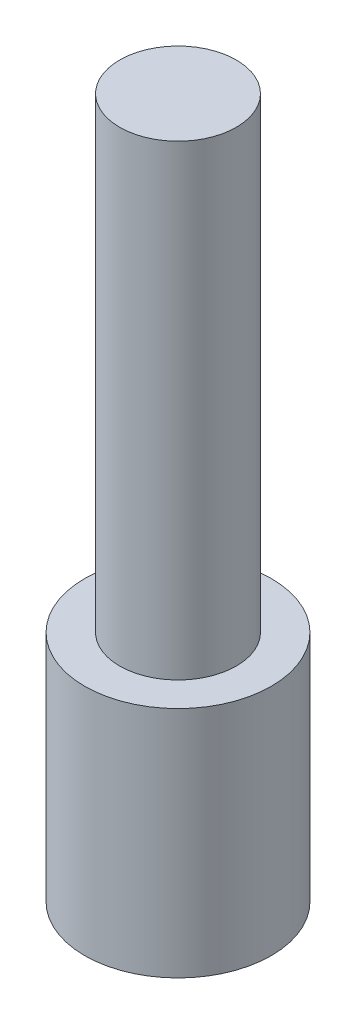
from build123d import *

# Parameters (mm, degrees)
SKETCH1_R           = 2.5
BOSS_EXTRUDE1_DEPTH = 20
SKETCH2_R           = 4
BOSS_EXTRUDE2_DEPTH = 10


with BuildPart() as part:
    # Sketch1 → Boss-Extrude1 (new body)
    with BuildSketch(Plane(origin=(0, 0, 0), x_dir=(1, 0, 0), z_dir=(0, 1, 0))):
        with Locations(Location((0, 0, 0), (0, 0, 270))):
            Circle(SKETCH1_R)
    extrude(amount=BOSS_EXTRUDE1_DEPTH)

    # Sketch2 → Boss-Extrude2 (add)
    with BuildSketch(Plane.XZ):
        with Locations(Location((0, 0, 0), (0, 0, 270))):
            Circle(SKETCH2_R)
    extrude(amount=BOSS_EXTRUDE2_DEPTH)


solid = part.part
